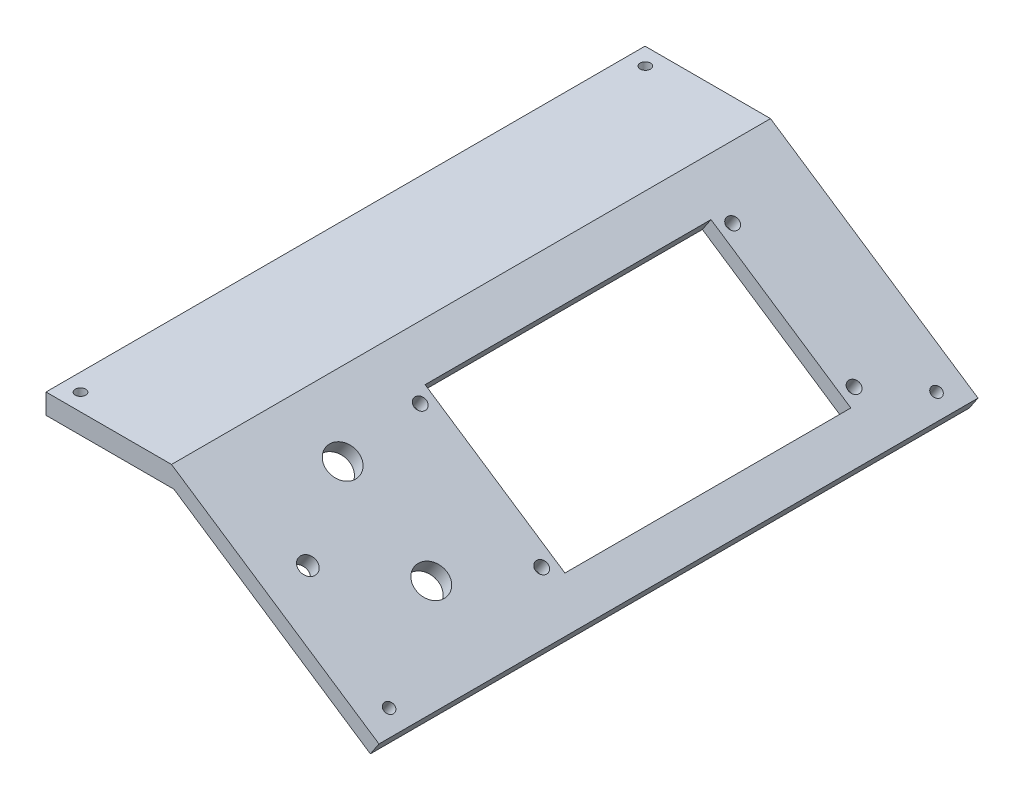
from build123d import *

# Parameters (mm, degrees)
RESSALTO_EXTRUS_O1_DEPTH = 171.8
ESBO_O2_R                = 1.75
ESBO_O2_R_2              = 4.5
ESBO_O2_R_3              = 2.5
ESBO_O2_R_4              = 1.5
ESBO_O2_W                = 48.2
ESBO_O2_H                = 82
CORTE_EXTRUS_O1_DEPTH    = 91.8
ESBO_O3_R                = 1.5
CORTE_EXTRUS_O2_DEPTH    = 91.8


with BuildPart() as part:
    # Esboço1 → Ressalto-extrusão1 (new body)
    with BuildSketch(Plane.XY):
        Polygon((0, 0), (36, 0), (95.500769823, -39.667179882), (93.03235395, -43.369803692), (36.677648412, -5.8), (0, -5.8), align=None)
    extrude(amount=RESSALTO_EXTRUS_O1_DEPTH)

    # Esboço2 → Corte-extrusão1 (cut)
    with BuildSketch(Plane(origin=(11.076923077, 16.615384615, 0), x_dir=(0.8320502943378437, -0.5547001962252291, 0), z_dir=(0.5547001962252291, 0.8320502943378437, 0))):
        with Locations(Location((44.779323351, -112.8, 0), (0, 0, 180))):
            Circle(ESBO_O2_R)
        with Locations(Location((86.639323351, -112.8, 0), (0, 0, 180))):
            Circle(ESBO_O2_R)
        with Locations(Location((44.779323351, -23.2, 0), (0, 0, 180))):
            Circle(ESBO_O2_R)
        with Locations(Location((86.639323351, -23.2, 0), (0, 0, 180))):
            Circle(ESBO_O2_R)
        with Locations(Location((77.664836105, -137, 0), (0, 0, 180))):
            Circle(ESBO_O2_R_2)
        with Locations(Location((47.118170034, -137, 0), (0, 0, 180))):
            Circle(ESBO_O2_R_2)
        with Locations(Location((62.164836105, -159.5, 0), (0, 0, 180))):
            Circle(ESBO_O2_R_3)
        with Locations(Location((96.064836105, -164.4, 0), (0, 0, 180))):
            Circle(ESBO_O2_R_4)
        with Locations(Location((96.064836105, -7.4, 0), (0, 0, 180))):
            Circle(ESBO_O2_R_4)
        with Locations((65.983311741, -68)):
            Rectangle(ESBO_O2_W, ESBO_O2_H)
    extrude(amount=-CORTE_EXTRUS_O1_DEPTH, mode=Mode.SUBTRACT)

    # Esboço3 → Corte-extrusão2 (cut)
    with BuildSketch(Plane(origin=(0, 0, 0), x_dir=(1, 0, 0), z_dir=(0, 1, 0))):
        with Locations(Location((5, -166.9, 0), (0, 0, 270))):
            Circle(ESBO_O3_R)
        with Locations(Location((5, -4.9, 0), (0, 0, 270))):
            Circle(ESBO_O3_R)
    extrude(amount=-CORTE_EXTRUS_O2_DEPTH, mode=Mode.SUBTRACT)


solid = part.part
